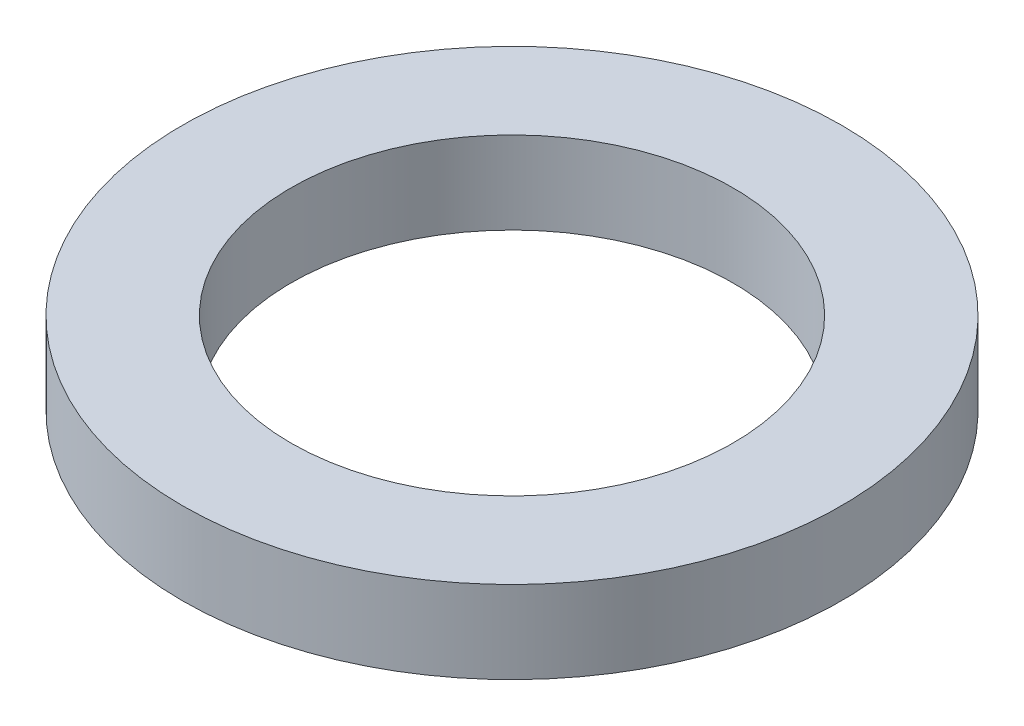
from build123d import *

# Parameters (mm, degrees)
SKETCH_1_W = 1.975
SKETCH_1_H = 1.5


with BuildPart() as part:
    # Эскиз1 → Повернуть1 (revolve)
    with BuildSketch(Plane(origin=(0, 0, 0), x_dir=(-1, 0, 0), z_dir=(0, 0, -1)), mode=Mode.PRIVATE) as revolve_1_sk:
        with Locations((-5.0125, 0.75)):
            Rectangle(SKETCH_1_W, SKETCH_1_H)
    revolve(revolve_1_sk.sketch.rotate(Axis((0, 0, 0), (0, 1, 0)), 270), axis=Axis((0, 0, 0), (0, 1, 0)))


solid = part.part
